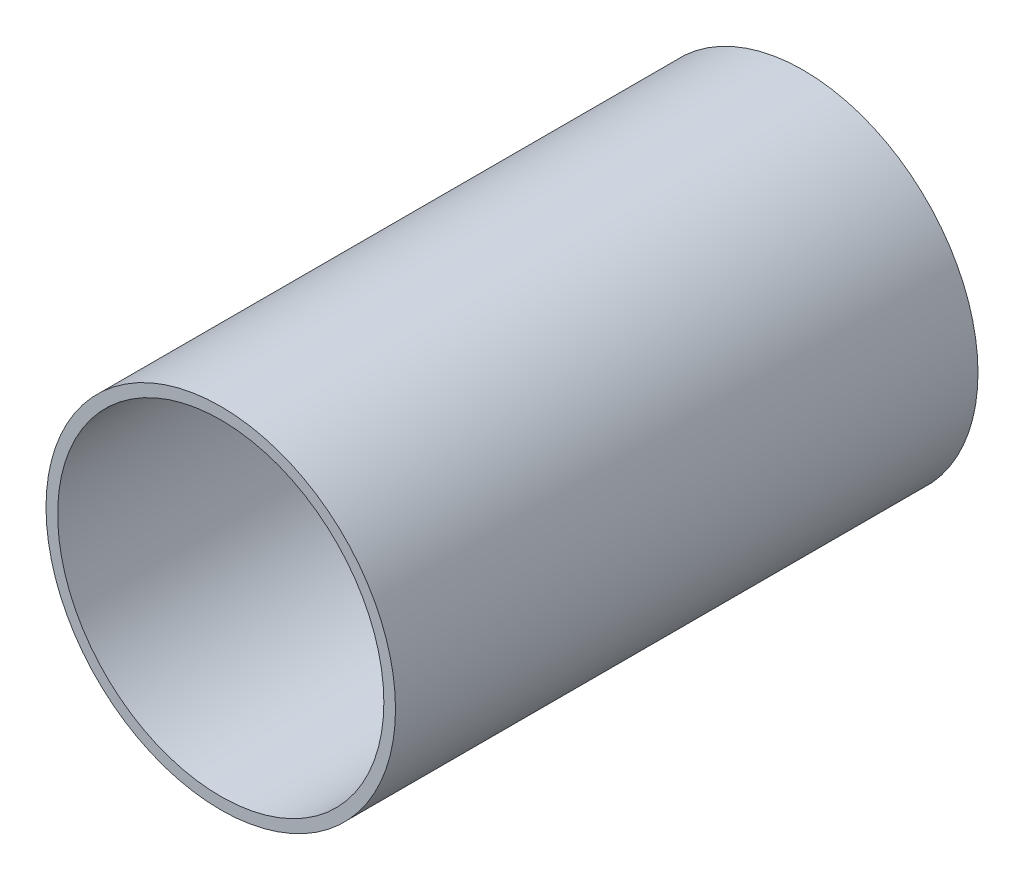
from build123d import *

# Parameters (mm, degrees)
SKETCH1_R           = 45
SKETCH1_R_2         = 42
BOSS_EXTRUDE1_DEPTH = 150


with BuildPart() as part:
    # Sketch1 → Boss-Extrude1 (new body)
    with BuildSketch(Plane.XY):
        Circle(SKETCH1_R)
        Circle(SKETCH1_R_2, mode=Mode.SUBTRACT)
    extrude(amount=BOSS_EXTRUDE1_DEPTH)


solid = part.part
